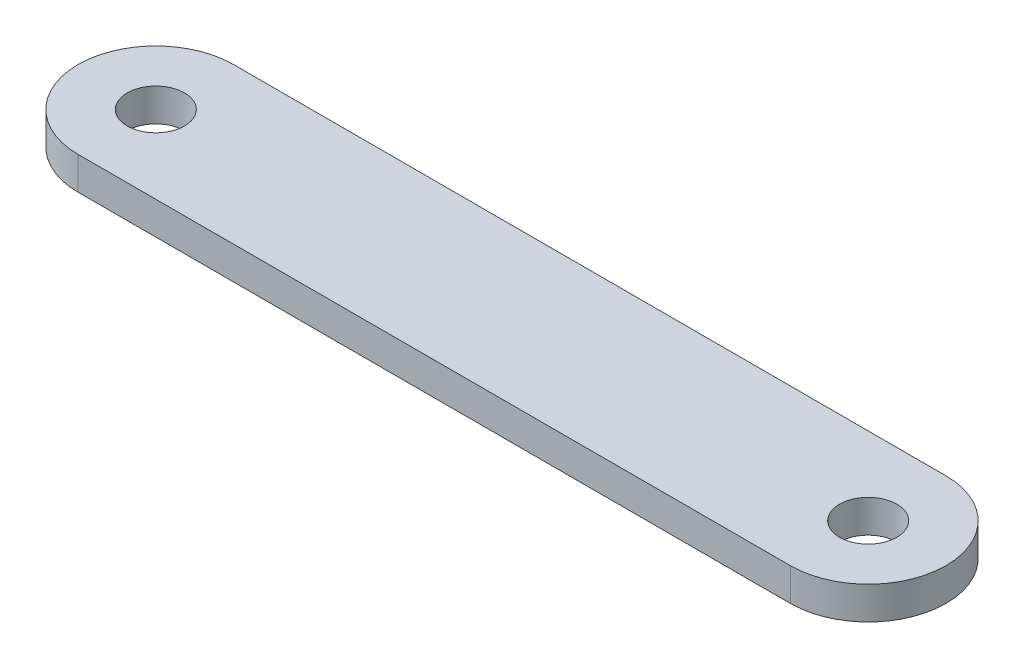
from build123d import *

# Parameters (mm, degrees)
SKETCH1_R           = 1.75
BOSS_EXTRUDE1_DEPTH = 2


with BuildPart() as part:
    # Sketch1 → Boss-Extrude1 (new body)
    with BuildSketch(Plane(origin=(0, 0, 0), x_dir=(1, 0, 0), z_dir=(0, 1, 0))):
        with BuildLine():
            Line((0, 4.75), (43.5, 4.75))
            ThreePointArc((43.5, 4.75), (48.25, 0), (43.5, -4.75))
            Line((43.5, -4.75), (0, -4.75))
            ThreePointArc((0, -4.75), (-4.75, 0), (0, 4.75))
        make_face()
        with Locations(Location((0, 0, 0), (0, 0, 270))):
            Circle(SKETCH1_R, mode=Mode.SUBTRACT)
        with Locations(Location((43.5, 0, 0), (0, 0, 270))):
            Circle(SKETCH1_R, mode=Mode.SUBTRACT)
    extrude(amount=BOSS_EXTRUDE1_DEPTH)


solid = part.part
